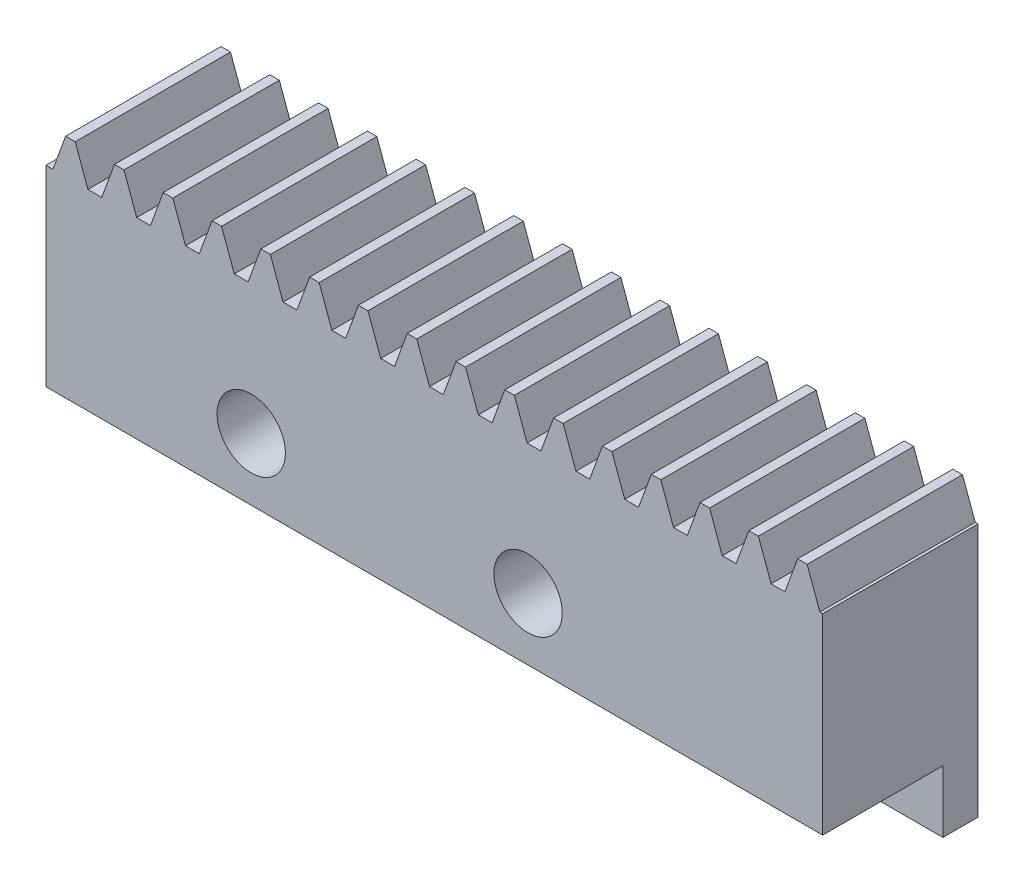
from build123d import *

# Parameters (mm, degrees)
BLANKSKE_W          = 25
BLANKSKE_H          = 7.3
BLANK_DEPTH         = 4
TOOTHCUTSIM_DEPTH   = 27.349383294
TEETHCUTS_COUNT     = 17
TEETHCUTS_PITCH     = 1.570796325
SKETCH4_W           = 25
SKETCH4_H           = 1.13
BOSS_EXTRUDE1_DEPTH = 2
BOSS_EXTRUDE2_DEPTH = 1
CUT_EXTRUDE1_DEPTH  = 10
SKETCH10_R          = 2
CUT_EXTRUDE3_DEPTH  = 1


with BuildPart() as part:
    # BlankSke → Blank (new body)
    with BuildSketch(Plane.XY):
        with Locations((12.5, 3.65)):
            Rectangle(BLANKSKE_W, BLANKSKE_H)
    extrude(amount=-BLANK_DEPTH)

    # TooCutSkeSim → ToothCutSim (cut, through all)
    with BuildSketch(Plane.XY):
        Polygon((0.222217685, 6.175), (-0.222217685, 6.175), (-0.640929042, 7.3254), (0.640929042, 7.3254), align=None)
    toothcutsim = extrude(amount=-TOOTHCUTSIM_DEPTH, mode=Mode.SUBTRACT)

    # TeethCuts: ToothCutSim ×17
    with Locations(*[(i * TEETHCUTS_PITCH, 0, 0) for i in range(1, TEETHCUTS_COUNT)]):
        add(toothcutsim, mode=Mode.SUBTRACT)

    # Sketch4 → Boss-Extrude1 (add)
    with BuildSketch(Plane.XZ):
        with Locations((12.5, -3.435)):
            Rectangle(SKETCH4_W, SKETCH4_H)
    extrude(amount=BOSS_EXTRUDE1_DEPTH)

    # Sketch7 → Boss-Extrude2 (add)
    with BuildSketch(Plane.XY):
        Polygon((25, 6.175), (24.910523515, 6.175), (24.501057002, 7.3), (24.193629073, 7.3), (23.78416256, 6.175), (23.33972719, 6.175), (22.930260677, 7.3), (22.622832748, 7.3), (22.213366235, 6.175), (21.768930865, 6.175), (21.359464352, 7.3), (21.052036423, 7.3), (20.64256991, 6.175), (20.19813454, 6.175), (19.788668027, 7.3), (19.481240098, 7.3), (19.071773585, 6.175), (18.627338215, 6.175), (18.217871702, 7.3), (17.910443773, 7.3), (17.50097726, 6.175), (17.05654189, 6.175), (16.647075377, 7.3), (16.339647448, 7.3), (15.930180935, 6.175), (15.485745565, 6.175), (15.076279052, 7.3), (14.768851123, 7.3), (14.35938461, 6.175), (13.91494924, 6.175), (13.505482727, 7.3), (13.198054798, 7.3), (12.788588285, 6.175), (12.344152915, 6.175), (11.934686402, 7.3), (11.627258473, 7.3), (11.21779196, 6.175), (10.77335659, 6.175), (10.363890077, 7.3), (10.056462148, 7.3), (9.646995635, 6.175), (9.202560265, 6.175), (8.793093752, 7.3), (8.485665823, 7.3), (8.07619931, 6.175), (7.63176394, 6.175), (7.222297427, 7.3), (6.914869498, 7.3), (6.505402985, 6.175), (6.060967615, 6.175), (5.651501102, 7.3), (5.344073173, 7.3), (4.93460666, 6.175), (4.49017129, 6.175), (4.080704777, 7.3), (3.773276848, 7.3), (3.363810335, 6.175), (2.919374965, 6.175), (2.509908452, 7.3), (2.202480523, 7.3), (1.79301401, 6.175), (1.34857864, 6.175), (0.939112127, 7.3), (0.631684198, 7.3), (0.222217685, 6.175), (0, 6.175), (0, 0), (25, 0), align=None)
    extrude(amount=BOSS_EXTRUDE2_DEPTH)

    # Sketch8 → Cut-Extrude1 (cut)
    with BuildSketch(Plane.XY.offset(1)):
        with BuildLine():
            ThreePointArc((16.617517337, 2), (15.517517337, 3.1), (14.417517337, 2))
            Line((14.417517337, 2), (15.517517337, 2))
            Line((15.517517337, 2), (16.617517337, 2))
        make_face()
        with BuildLine():
            Line((15.517517337, 2), (14.417517337, 2))
            ThreePointArc((14.417517337, 2), (15.517517337, 0.9), (16.617517337, 2))
            Line((16.617517337, 2), (15.517517337, 2))
        make_face()
        with BuildLine():
            ThreePointArc((16.617517337, 2), (15.517517337, 3.1), (14.417517337, 2))
            Line((14.417517337, 2), (15.517517337, 2))
            Line((15.517517337, 2), (16.617517337, 2))
        make_face()
        with BuildLine():
            Line((15.517517337, 2), (14.417517337, 2))
            ThreePointArc((14.417517337, 2), (15.517517337, 0.9), (16.617517337, 2))
            Line((16.617517337, 2), (15.517517337, 2))
        make_face()
        with BuildLine():
            Line((7.705669439, 2), (6.605669439, 2))
            Line((6.605669439, 2), (5.505669439, 2))
            ThreePointArc((5.505669439, 2), (6.605669439, 0.9), (7.705669439, 2))
        make_face()
        with BuildLine():
            Line((5.505669439, 2), (6.605669439, 2))
            Line((6.605669439, 2), (7.705669439, 2))
            ThreePointArc((7.705669439, 2), (6.605669439, 3.1), (5.505669439, 2))
        make_face()
        with BuildLine():
            Line((7.705669439, 2), (6.605669439, 2))
            Line((6.605669439, 2), (5.505669439, 2))
            ThreePointArc((5.505669439, 2), (6.605669439, 0.9), (7.705669439, 2))
        make_face()
        with BuildLine():
            Line((5.505669439, 2), (6.605669439, 2))
            Line((6.605669439, 2), (7.705669439, 2))
            ThreePointArc((7.705669439, 2), (6.605669439, 3.1), (5.505669439, 2))
        make_face()
    extrude(amount=-CUT_EXTRUDE1_DEPTH, mode=Mode.SUBTRACT)

    # Sketch10 → Cut-Extrude3 (cut)
    with BuildSketch(Plane(origin=(0, 0, -4), x_dir=(-1, 0, 0), z_dir=(0, 0, -1))):
        with Locations((-6.605669439, 2)):
            Circle(SKETCH10_R)
    extrude(amount=-CUT_EXTRUDE3_DEPTH, mode=Mode.SUBTRACT)


solid = part.part
